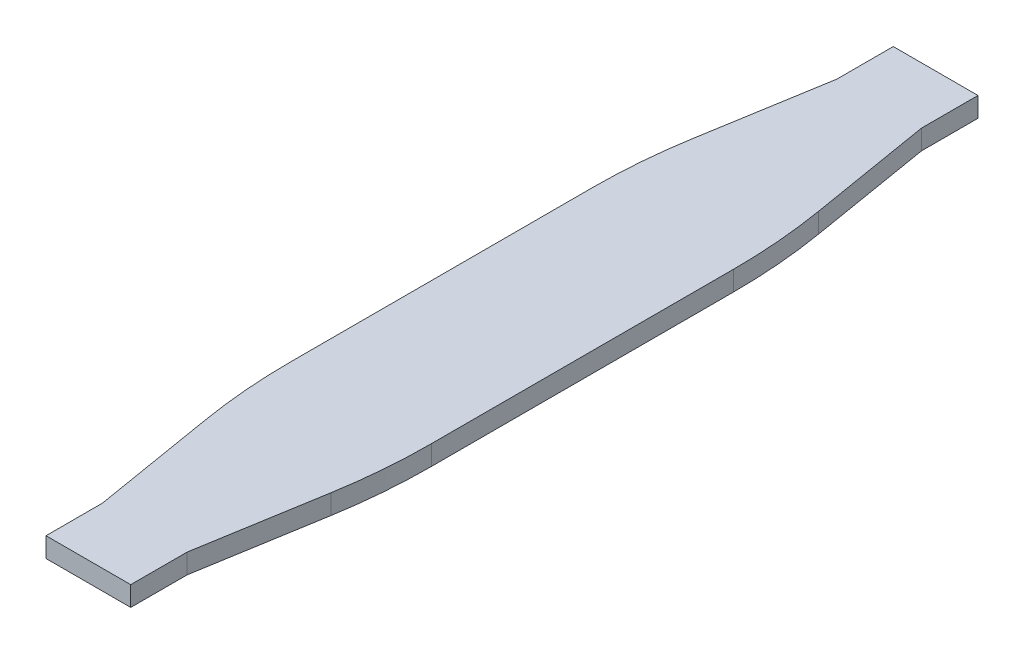
from build123d import *

# Parameters (mm, degrees)
BOSS_EXTRUDE1_DEPTH = 0.35
FILLET1_R           = 10


with BuildPart() as part:
    # Sketch1 → Boss-Extrude1 (new body)
    with BuildSketch(Plane(origin=(0, 0, 0.002129552), x_dir=(1, 0, 0), z_dir=(0, 1, 0))):
        Polygon((65.957189, 129.495721477), (66.457189, 132.495721477), (66.457189, 139.495721477), (65.957189, 142.495721477), (65.957189, 143.495721477), (64.457189, 143.495721477), (64.457189, 142.495721477), (63.957189, 139.495721477), (63.957189, 132.495721477), (64.457189, 129.495721477), (64.457189, 128.495721477), (65.207189, 128.495721477), (65.957189, 128.495721477), align=None)
    extrude(amount=BOSS_EXTRUDE1_DEPTH)

    # Fillet1
    fillet1_edges = [part.edges().sort_by_distance(p)[0] for p in [
        (66.457189, 0.175, -132.493591924),
        (63.957189, 0.175, -132.493591924),
        (63.957189, 0.175, -139.493591924),
        (66.457189, 0.175, -139.493591924),
    ]]
    fillet(fillet1_edges, radius=FILLET1_R)


solid = part.part
